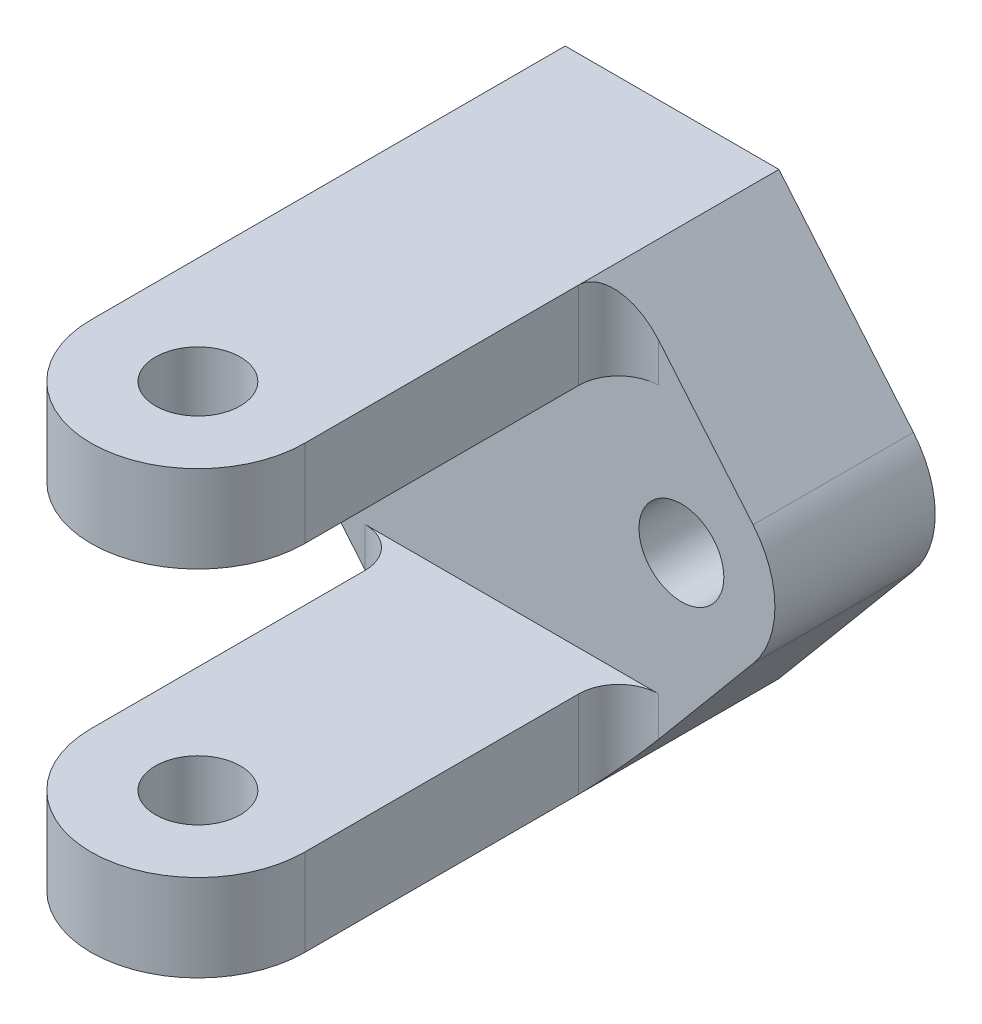
from build123d import *

# Parameters (mm, degrees)
SKETCH1_W                      = 41.4
SKETCH1_H                      = 33.02
SKETCH1_R                      = 3.175
BOSS_EXTRUDE1_DEPTH            = 12
SKETCH2_W                      = 41.4
SKETCH2_H                      = 6.51
BOSS_EXTRUDE2_DEPTH            = 53
CUT_EXTRUDE1_REACH             = 72.186
SKETCH4_R                      = 3.175
CUT_EXTRUDE1_DIRECTION_2_REACH = 72.186
CUT_EXTRUDE3_REACH             = 72.186
CUT_EXTRUDE3_DIRECTION_2_REACH = 72.186
CUT_EXTRUDE4_DEPTH             = 12
BOSS_EXTRUDE3_DEPTH            = 12
FILLET3_R                      = 3


with BuildPart() as part:
    # Sketch1 → Boss-Extrude1 (new body)
    with BuildSketch(Plane.XY):
        Rectangle(SKETCH1_W, SKETCH1_H)
        with Locations((12.7, 0)):
            Circle(SKETCH1_R, mode=Mode.SUBTRACT)
        with Locations((-12.7, 0)):
            Circle(SKETCH1_R, mode=Mode.SUBTRACT)
    extrude(amount=BOSS_EXTRUDE1_DEPTH)

    # Sketch2 → Boss-Extrude2 (add)
    with BuildSketch(Plane.XY.offset(12)):
        with Locations((0, 13.255)):
            Rectangle(SKETCH2_W, SKETCH2_H)
        with Locations((0, -13.255)):
            Rectangle(SKETCH2_W, SKETCH2_H)
    extrude(amount=BOSS_EXTRUDE2_DEPTH)

    # Cut-Extrude1: up to this face of the body (flat: up to its plane)
    cut_extrude1_end = Plane(part.part.faces().sort_by_distance((0, -16.51, 32.5))[0])
    # Sketch4 → Cut-Extrude1 (cut, up to the picked face)
    with BuildSketch(Plane(origin=(0, 0, 0), x_dir=(1, 0, 0), z_dir=(0, 1, 0)), mode=Mode.PRIVATE) as cut_extrude1_sk1:
        with Locations(Location((0, -35.5, 0), (0, 0, 270))):
            Circle(SKETCH4_R)
    cut_extrude1_tool1 = split(extrude(cut_extrude1_sk1.sketch, amount=-CUT_EXTRUDE1_REACH, mode=Mode.PRIVATE), bisect_by=cut_extrude1_end, keep=Keep.BOTH, mode=Mode.PRIVATE)
    add(cut_extrude1_tool1.solids().sort_by(Axis((0, 0, 35.5), (0, -1, 0)))[0], mode=Mode.SUBTRACT)

    # Cut-Extrude1 direction 2: up to this face of the body (flat: up to its plane)
    cut_extrude1_direction_2_end = Plane(part.part.faces().sort_by_distance((0, 16.51, 32.5))[0])
    # Sketch4 → Cut-Extrude1 direction 2 (cut, up to the picked face)
    with BuildSketch(Plane(origin=(0, 0, 0), x_dir=(1, 0, 0), z_dir=(0, 1, 0)), mode=Mode.PRIVATE) as cut_extrude1_direction_2_sk1:
        with Locations(Location((0, -35.5, 0), (0, 0, 270))):
            Circle(SKETCH4_R)
    cut_extrude1_direction_2_tool1 = split(extrude(cut_extrude1_direction_2_sk1.sketch, amount=CUT_EXTRUDE1_DIRECTION_2_REACH, mode=Mode.PRIVATE), bisect_by=cut_extrude1_direction_2_end, keep=Keep.BOTH, mode=Mode.PRIVATE)
    add(cut_extrude1_direction_2_tool1.solids().sort_by(Axis((0, 0, 35.5), (0, 1, 0)))[0], mode=Mode.SUBTRACT)

    # Cut-Extrude3: up to this face of the body (flat: up to its plane)
    cut_extrude3_end = Plane(part.part.faces().sort_by_distance((-19.929353518, -16.51, 32.5))[0])
    # Sketch6 → Cut-Extrude3 (cut, up to the picked face)
    with BuildSketch(Plane(origin=(0, 0, 0), x_dir=(1, 0, 0), z_dir=(0, 1, 0)), mode=Mode.PRIVATE) as cut_extrude3_sk1:
        with BuildLine():
            Line((-8, -35.5), (-8, -20))
            Line((-8, -20), (-8, -12))
            Line((-8, -12), (-16, -12))
            Line((-16, -12), (-20.7, -12))
            Line((-20.7, -12), (-20.7, -65))
            Line((-20.7, -65), (20.7, -65))
            Line((20.7, -65), (20.7, -12))
            Line((20.7, -12), (16, -12))
            Line((16, -12), (8, -12))
            Line((8, -12), (8, -20))
            Line((8, -20), (8, -35.5))
            ThreePointArc((8, -35.5), (0, -43.5), (-8, -35.5))
        make_face()
    cut_extrude3_tool1 = split(extrude(cut_extrude3_sk1.sketch, amount=-CUT_EXTRUDE3_REACH, mode=Mode.PRIVATE), bisect_by=cut_extrude3_end, keep=Keep.BOTH, mode=Mode.PRIVATE)
    add(cut_extrude3_tool1.solids().sort_by(Axis((-8.67253, 0, 27.75), (0, -1, 0)))[0], mode=Mode.SUBTRACT)

    # Cut-Extrude3 direction 2: up to this face of the body (flat: up to its plane)
    cut_extrude3_direction_2_end = Plane(part.part.faces().sort_by_distance((19.929353518, 16.51, 32.5))[0])
    # Sketch6 → Cut-Extrude3 direction 2 (cut, up to the picked face)
    with BuildSketch(Plane(origin=(0, 0, 0), x_dir=(1, 0, 0), z_dir=(0, 1, 0)), mode=Mode.PRIVATE) as cut_extrude3_direction_2_sk1:
        with BuildLine():
            Line((-8, -35.5), (-8, -20))
            Line((-8, -20), (-8, -12))
            Line((-8, -12), (-16, -12))
            Line((-16, -12), (-20.7, -12))
            Line((-20.7, -12), (-20.7, -65))
            Line((-20.7, -65), (20.7, -65))
            Line((20.7, -65), (20.7, -12))
            Line((20.7, -12), (16, -12))
            Line((16, -12), (8, -12))
            Line((8, -12), (8, -20))
            Line((8, -20), (8, -35.5))
            ThreePointArc((8, -35.5), (0, -43.5), (-8, -35.5))
        make_face()
    cut_extrude3_direction_2_tool1 = split(extrude(cut_extrude3_direction_2_sk1.sketch, amount=CUT_EXTRUDE3_DIRECTION_2_REACH, mode=Mode.PRIVATE), bisect_by=cut_extrude3_direction_2_end, keep=Keep.BOTH, mode=Mode.PRIVATE)
    add(cut_extrude3_direction_2_tool1.solids().sort_by(Axis((-8.67253, 0, 27.75), (0, 1, 0)))[0], mode=Mode.SUBTRACT)

    # Sketch7 → Cut-Extrude4 (cut)
    with BuildSketch(Plane.XY):
        with BuildLine():
            ThreePointArc((-12.7, 7), (-19.7, 0), (-12.7, -7))
            Line((-12.7, -7), (-8, -7))
            Line((-8, -7), (-8, -16.51))
            Line((-8, -16.51), (-20.7, -16.51))
            Line((-20.7, -16.51), (-20.7, 16.51))
            Line((-20.7, 16.51), (-8, 16.51))
            Line((-8, 16.51), (-8, 7))
            Line((-8, 7), (-12.7, 7))
        make_face()
        with BuildLine():
            Line((12.7, 7), (8, 7))
            Line((8, 7), (8, 16.51))
            Line((8, 16.51), (20.7, 16.51))
            Line((20.7, 16.51), (20.7, -16.51))
            Line((20.7, -16.51), (8, -16.51))
            Line((8, -16.51), (8, -7))
            Line((8, -7), (12.7, -7))
            ThreePointArc((12.7, -7), (19.7, 0), (12.7, 7))
        make_face()
    extrude(amount=CUT_EXTRUDE4_DEPTH, mode=Mode.SUBTRACT)

    # Sketch8 → Boss-Extrude3 (add)
    with BuildSketch(Plane.XY):
        with BuildLine():
            Line((8, -16.51), (18.065759147, -4.495400847))
            ThreePointArc((18.065759147, -4.495400847), (15.660759537, -6.343020019), (12.7, -7))
            Line((12.7, -7), (8, -7))
            Line((8, -7), (8, -16.51))
        make_face()
        with BuildLine():
            ThreePointArc((-18.065759147, -4.495400847), (-15.660759537, -6.343020019), (-12.7, -7))
            Line((-12.7, -7), (-8, -7))
            Line((-8, -7), (-8, -16.51))
            Line((-8, -16.51), (-18.065759147, -4.495400847))
        make_face()
        with BuildLine():
            Line((8, 16.51), (18.065759147, 4.495400847))
            ThreePointArc((18.065759147, 4.495400847), (15.660759537, 6.343020019), (12.7, 7))
            Line((12.7, 7), (8, 7))
            Line((8, 7), (8, 16.51))
        make_face()
        with BuildLine():
            Line((-8, 16.51), (-18.065759147, 4.495400847))
            ThreePointArc((-18.065759147, 4.495400847), (-15.660759537, 6.343020019), (-12.7, 7))
            Line((-12.7, 7), (-8, 7))
            Line((-8, 7), (-8, 16.51))
        make_face()
    extrude(amount=BOSS_EXTRUDE3_DEPTH)

    # Fillet3
    fillet3_edges = [part.edges().sort_by_distance(p)[0] for p in [
        (8, -13.255, 12),
        (-8, -13.255, 12),
        (8, 13.255, 12),
        (-8, 13.255, 12),
    ]]
    fillet(fillet3_edges, radius=FILLET3_R)


solid = part.part
